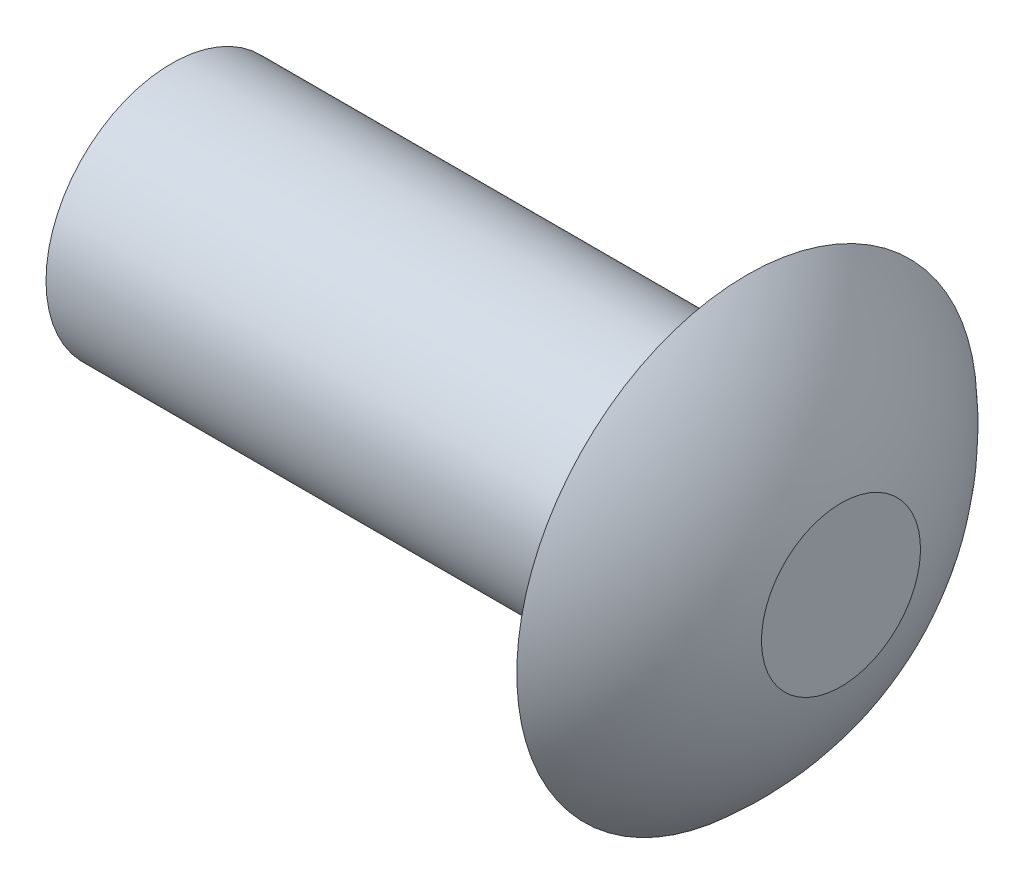
from build123d import *


with BuildPart() as part:
    # Sketch1 → Revolve1 (revolve)
    with BuildSketch(Plane.XY):
        with BuildLine():
            Line((-6.875797963, 1.5), (0, 1.5))
            Line((0, 1.5), (0, 2.75))
            ThreePointArc((0, 2.75), (0.695810467, 1.93350913), (1.124202037, 0.95))
            Line((1.124202037, 0.95), (1.124202037, 0))
            Line((1.124202037, 0), (-6.875797963, 0))
            Line((-6.875797963, 0), (-6.875797963, 1.5))
        make_face()
    revolve(axis=Axis((-1000, 0, 0), (1, 0, 0)))


solid = part.part
